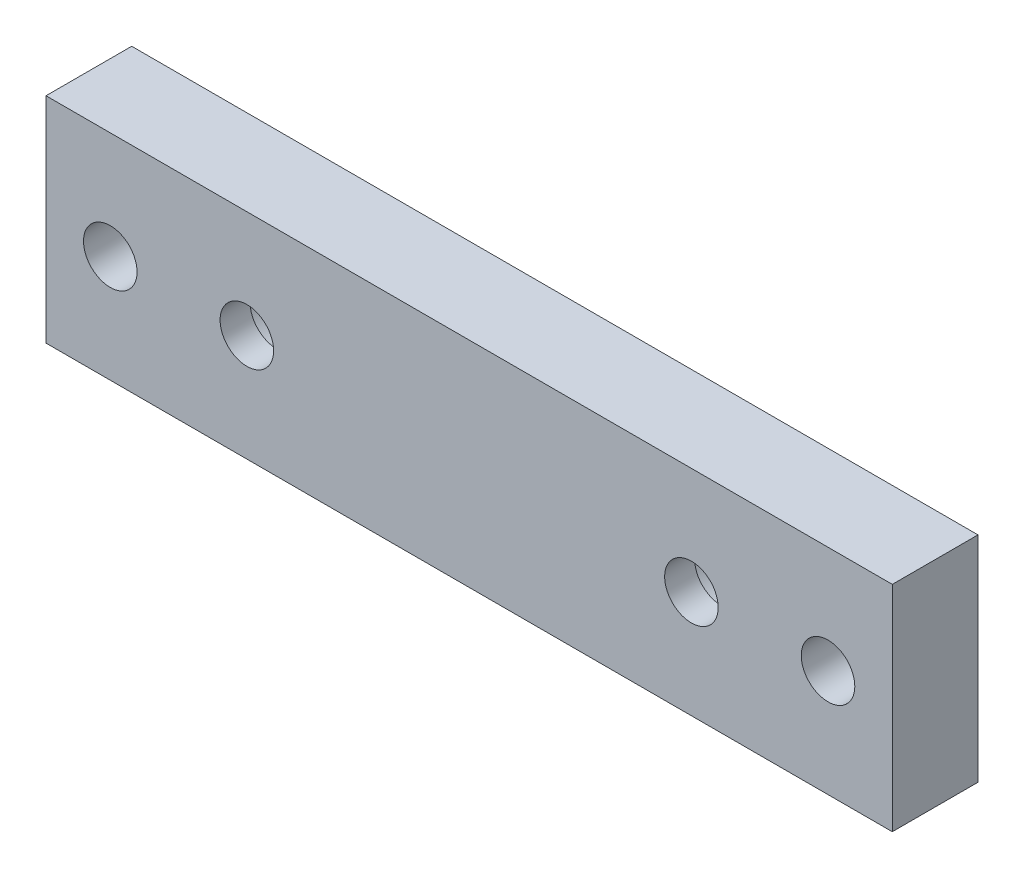
from build123d import *

# Parameters (mm, degrees)
SKETCH_1_W          = 79
SKETCH_1_H          = 20
SKETCH_1_R          = 2.5
EXTRUDE_1_DEPTH     = 8
SKETCH_1_3_R        = 4.5
CUT_EXTRUDE_1_DEPTH = 5.2
SKETCH_1_4_R        = 4.5
CUT_EXTRUDE_2_DEPTH = 5.2


with BuildPart() as part:
    # 草图1 → 凸台-拉伸1 (new body)
    with BuildSketch(Plane.XY):
        with Locations((-19.987727126, 36.540514884)):
            Rectangle(SKETCH_1_W, SKETCH_1_H)
        with Locations((-40.737727126, 36.540514884)):
            Circle(SKETCH_1_R, mode=Mode.SUBTRACT)
        with Locations((-53.487727126, 36.540514884)):
            Circle(SKETCH_1_R, mode=Mode.SUBTRACT)
        with Locations((13.512272874, 36.540514884)):
            Circle(SKETCH_1_R, mode=Mode.SUBTRACT)
        with Locations((0.762272874, 36.540514884)):
            Circle(SKETCH_1_R, mode=Mode.SUBTRACT)
    extrude(amount=EXTRUDE_1_DEPTH)

    # 草图1<3> → 切除-拉伸1 (cut)
    with BuildSketch(Plane.XY):
        with Locations((0.762272874, 36.540514884)):
            Circle(SKETCH_1_3_R)
    extrude(amount=CUT_EXTRUDE_1_DEPTH, mode=Mode.SUBTRACT)

    # 草图1<4> → 切除-拉伸2 (cut)
    with BuildSketch(Plane.XY):
        with Locations((-40.737727126, 36.540514884)):
            Circle(SKETCH_1_4_R)
    extrude(amount=CUT_EXTRUDE_2_DEPTH, mode=Mode.SUBTRACT)


solid = part.part
